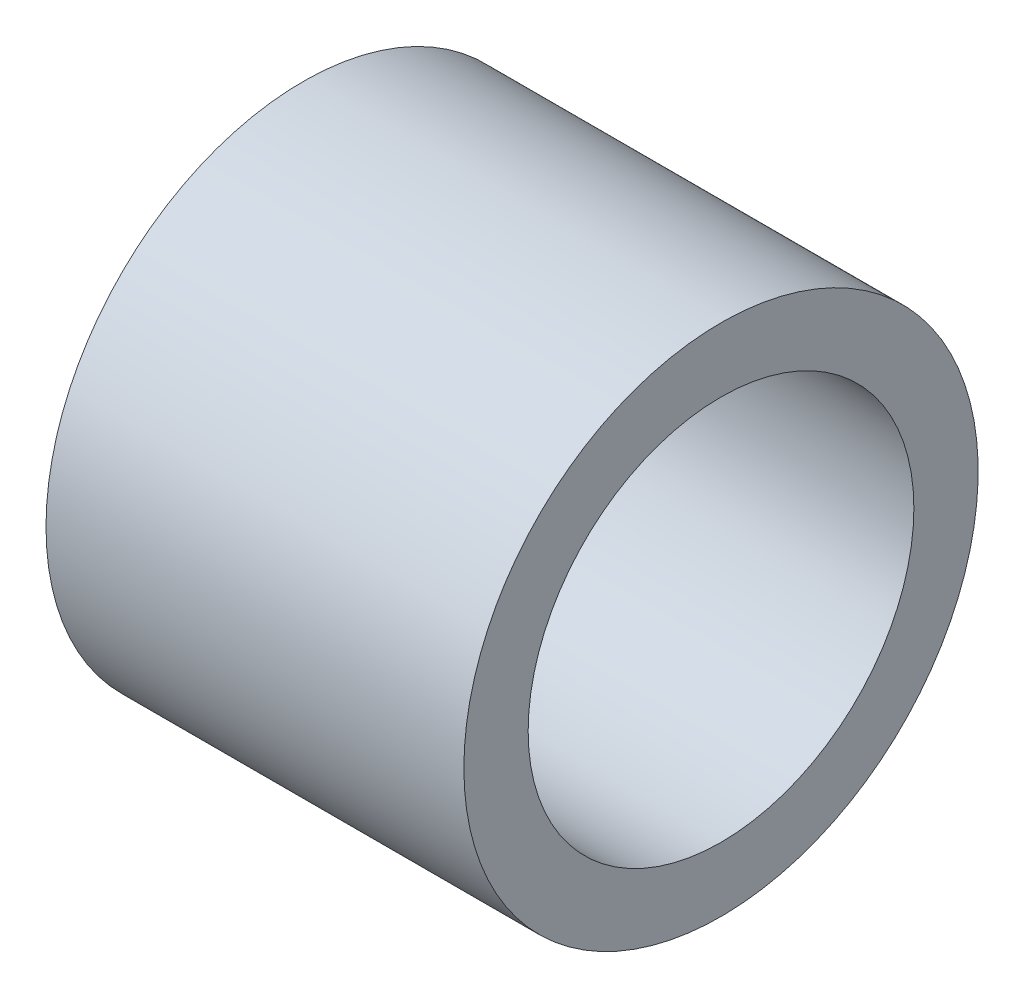
from build123d import *

# Parameters (mm, degrees)
SKETCH1_W = 6.5
SKETCH1_H = 1


with BuildPart() as part:
    # Sketch1 → Revolve1 (revolve)
    with BuildSketch(Plane.XY, mode=Mode.PRIVATE) as revolve1_sk:
        with Locations((3.25, 3.5)):
            Rectangle(SKETCH1_W, SKETCH1_H)
    revolve(revolve1_sk.sketch.rotate(Axis((0, 0, 0), (1, 0, 0)), 90), axis=Axis((0, 0, 0), (1, 0, 0)))


solid = part.part
